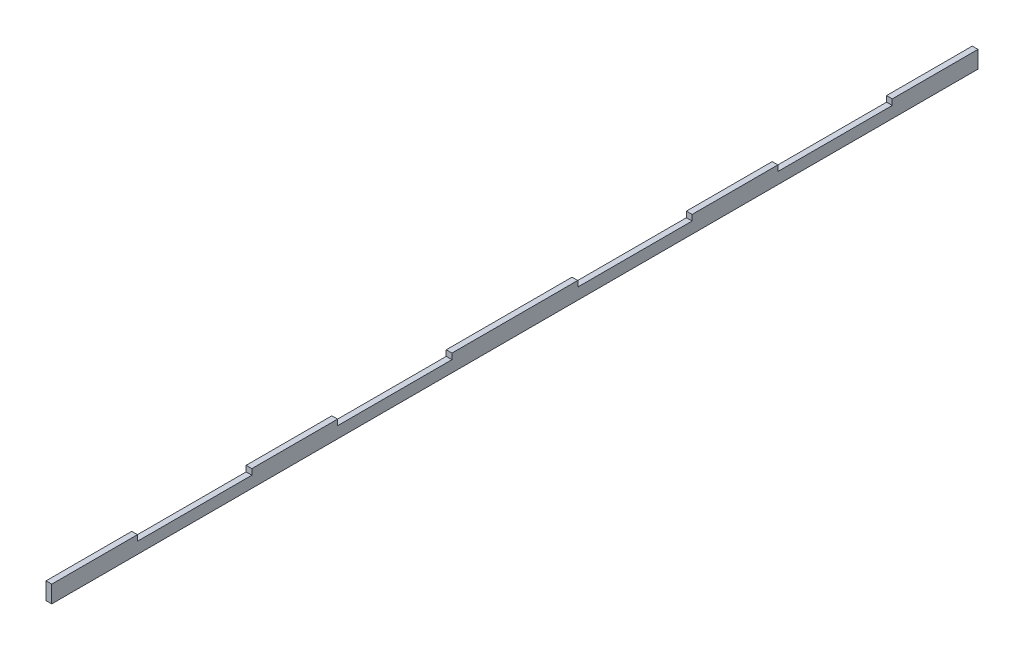
from build123d import *

# Parameters (mm, degrees)
SKETCH1_W           = 324
SKETCH1_H           = 6
BOSS_EXTRUDE1_DEPTH = 2
SKETCH2_W           = 40
SKETCH2_H           = 2
CUT_EXTRUDE1_DEPTH  = 2


with BuildPart() as part:
    # Sketch1 → Boss-Extrude1 (new body)
    with BuildSketch(Plane(origin=(0, 0, 0), x_dir=(0, 0, -1), z_dir=(1, 0, 0))):
        Rectangle(SKETCH1_W, SKETCH1_H)
    extrude(amount=BOSS_EXTRUDE1_DEPTH)

    # Sketch2 → Cut-Extrude1 (cut)
    with BuildSketch(Plane(origin=(2, 0, 0), x_dir=(0, 0, -1), z_dir=(1, 0, 0))):
        with Locations((-112, 2)):
            Rectangle(SKETCH2_W, SKETCH2_H)
        with Locations((-42, 2)):
            Rectangle(SKETCH2_W, SKETCH2_H)
        with Locations((42, 2)):
            Rectangle(SKETCH2_W, SKETCH2_H)
        with Locations((112, 2)):
            Rectangle(SKETCH2_W, SKETCH2_H)
    extrude(amount=-CUT_EXTRUDE1_DEPTH, mode=Mode.SUBTRACT)


solid = part.part
